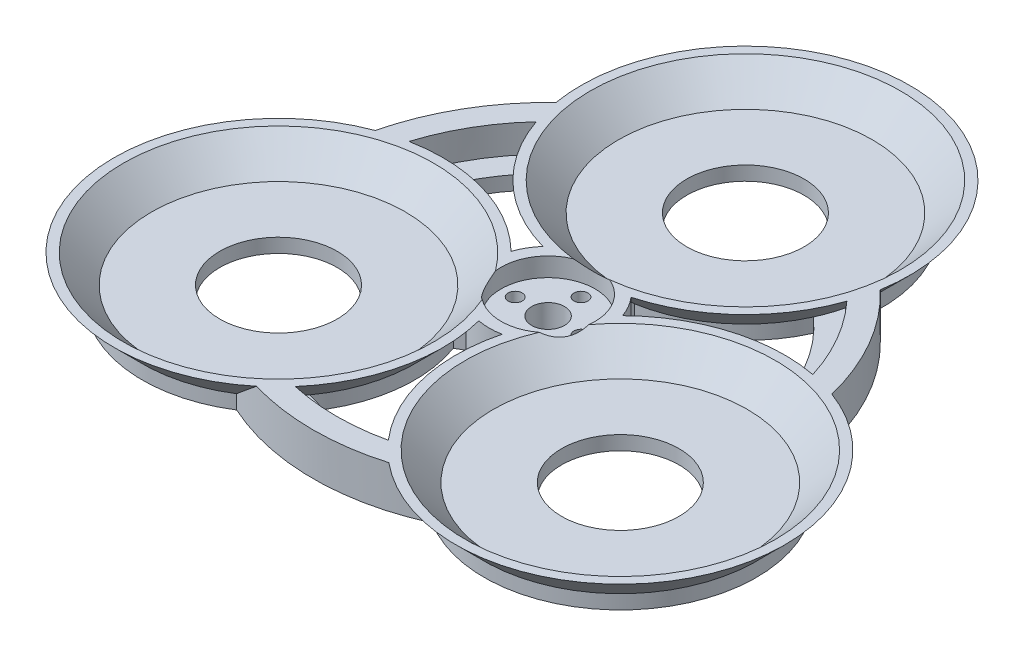
from build123d import *
from build123d.topology import SkipClean

# Parameters (mm, degrees)
SKETCH_1_R               = 10
SKETCH_1_R_2             = 1.5
SKETCH_1_R_3             = 3.5
EXTRUDE_1_DEPTH          = 5
SKETCH_3_R               = 12.5
SKETCH_3_R_2             = 10
EXTRUDE_2_DEPTH          = 9
EXTRUDE_3_DEPTH          = 3
EXTRUDE_4_DEPTH          = 6
PATTERN_CIRCULAR_1_COUNT = 3
SKETCH_13_R              = 12.5
CUT_EXTRUDE_2_DEPTH      = 10
PATTERN_CIRCULAR_2_COUNT = 3
CUT_EXTRUDE_START        = -4
SKETCH_18_R              = 10
CUT_EXTRUDE_3_DEPTH      = 4


with BuildPart() as part:
    # 草图1 → 凸台-拉伸1 (new body)
    with BuildSketch(Plane(origin=(0, 0, 0), x_dir=(1, 0, 0), z_dir=(0, 1, 0))):
        with Locations(Location((0, 0, 0), (0, 0, 270))):
            Circle(SKETCH_1_R)
        with Locations(Location((0, 7, 0), (0, 0, 270))):
            Circle(SKETCH_1_R_2, mode=Mode.SUBTRACT)
        with Locations(Location((0, 0, 0), (0, 0, 270))):
            Circle(SKETCH_1_R_3, mode=Mode.SUBTRACT)
        with Locations(Location((7, 0, 0), (0, 0, 270))):
            Circle(SKETCH_1_R_2, mode=Mode.SUBTRACT)
        with Locations(Location((0, -7, 0), (0, 0, 90))):
            Circle(SKETCH_1_R_2, mode=Mode.SUBTRACT)
        with Locations(Location((-7, 0, 0), (0, 0, 90))):
            Circle(SKETCH_1_R_2, mode=Mode.SUBTRACT)
    extrude(amount=EXTRUDE_1_DEPTH)

    # 草图3 → 凸台-拉伸2 (add)
    with BuildSketch(Plane.XZ):
        with Locations(Location((0, 0, 0), (0, 0, 270))):
            Circle(SKETCH_3_R)
        with Locations(Location((0, 0, 0), (0, 0, 270))):
            Circle(SKETCH_3_R_2, mode=Mode.SUBTRACT)
    extrude(amount=-EXTRUDE_2_DEPTH)

    # 草图4 → 凸台-拉伸3 (add)
    with BuildSketch(Plane(origin=(0, 0, 0), x_dir=(1, 0, 0), z_dir=(0, 1, 0))):
        with BuildLine():
            ThreePointArc((20.804011294, -45.466395437), (61.487803669, -35.5), (49.777059114, 4.716395437))
            ThreePointArc((49.777059114, 4.716395437), (43.301270189, 25), (28.97304782, 40.75))
            ThreePointArc((28.97304782, 40.75), (0, 71), (-28.97304782, 40.75))
            ThreePointArc((-28.97304782, 40.75), (-43.301270189, 25), (-49.777059114, 4.716395437))
            ThreePointArc((-49.777059114, 4.716395437), (-61.487803669, -35.5), (-20.804011294, -45.466395437))
            ThreePointArc((-20.804011294, -45.466395437), (0, -50), (20.804011294, -45.466395437))
        make_face()
        with BuildLine():
            Line((14.134433205, -2.387016124), (12.421567416, -1.3980926))
            ThreePointArc((12.421567416, -1.3980926), (10.825317547, -6.25), (7.421567416, -10.058346638))
            Line((7.421567416, -10.058346638), (9.134433205, -11.047270162))
            ThreePointArc((9.134433205, -11.047270162), (7.640087702, -24.92630908), (12.803210724, -37.895617097))
            ThreePointArc((12.803210724, -37.895617097), (0, -40), (-12.803210724, -37.895617097))
            ThreePointArc((-12.803210724, -37.895617097), (-7.640087702, -24.92630908), (-9.134433205, -11.047270162))
            Line((-9.134433205, -11.047270162), (-7.421567416, -10.058346638))
            ThreePointArc((-7.421567416, -10.058346638), (-10.825317547, -6.25), (-12.421567416, -1.3980926))
            Line((-12.421567416, -1.3980926), (-14.134433205, -2.387016124))
            ThreePointArc((-14.134433205, -2.387016124), (-25.406860737, 5.846644503), (-39.22017246, 7.859902811))
            ThreePointArc((-39.22017246, 7.859902811), (-34.641016151, 20), (-26.416961736, 30.035714286))
            ThreePointArc((-26.416961736, 30.035714286), (-17.766773035, 19.079664577), (-5, 13.434286286))
            Line((-5, 13.434286286), (-5, 11.456439237))
            ThreePointArc((-5, 11.456439237), (0, 12.5), (5, 11.456439237))
            Line((5, 11.456439237), (5, 13.434286286))
            ThreePointArc((5, 13.434286286), (17.766773035, 19.079664577), (26.416961736, 30.035714286))
            ThreePointArc((26.416961736, 30.035714286), (34.641016151, 20), (39.22017246, 7.859902811))
            ThreePointArc((39.22017246, 7.859902811), (25.406860737, 5.846644503), (14.134433205, -2.387016124))
        make_face(mode=Mode.SUBTRACT)
    extrude(amount=EXTRUDE_3_DEPTH)

    # 草图15 → 凸台-拉伸4 (add)
    with BuildSketch(Plane(origin=(0, 3, 0), x_dir=(1, 0, 0), z_dir=(0, 1, 0))):
        with BuildLine():
            Line((-5, 13.434286286), (-5, 11.456439237))
            ThreePointArc((-5, 11.456439237), (0, 12.5), (5, 11.456439237))
            Line((5, 11.456439237), (5, 13.434286286))
            ThreePointArc((5, 13.434286286), (0, 13), (-5, 13.434286286))
        make_face()
        with BuildLine():
            ThreePointArc((-7.421567416, -10.058346638), (-10.825317547, -6.25), (-12.421567416, -1.3980926))
            Line((-12.421567416, -1.3980926), (-14.134433205, -2.387016124))
            ThreePointArc((-14.134433205, -2.387016124), (-11.258330249, -6.5), (-9.134433205, -11.047270162))
            Line((-9.134433205, -11.047270162), (-7.421567416, -10.058346638))
        make_face()
        with BuildLine():
            ThreePointArc((-44.476374018, 6.844863345), (-38.97114317, 22.5), (-28.166012551, 35.095238095))
            ThreePointArc((-28.166012551, 35.095238095), (-28.709095041, 37.902700656), (-28.97304782, 40.75))
            ThreePointArc((-28.97304782, 40.75), (-43.301270189, 25), (-49.777059114, 4.716395437))
            ThreePointArc((-49.777059114, 4.716395437), (-47.179249161, 5.911455297), (-44.476374018, 6.844863345))
        make_face()
        with BuildLine():
            ThreePointArc((28.97304782, 40.75), (28.709095041, 37.902700656), (28.166012551, 35.095238095))
            ThreePointArc((28.166012551, 35.095238095), (38.97114317, 22.5), (44.476374018, 6.844863345))
            ThreePointArc((44.476374018, 6.844863345), (47.179249161, 5.911455297), (49.777059114, 4.716395437))
            ThreePointArc((49.777059114, 4.716395437), (43.301270189, 25), (28.97304782, 40.75))
        make_face()
        with BuildLine():
            Line((14.134433205, -2.387016124), (12.421567416, -1.3980926))
            ThreePointArc((12.421567416, -1.3980926), (10.825317547, -6.25), (7.421567416, -10.058346638))
            Line((7.421567416, -10.058346638), (9.134433205, -11.047270162))
            ThreePointArc((9.134433205, -11.047270162), (11.258330249, -6.5), (14.134433205, -2.387016124))
        make_face()
        with BuildLine():
            ThreePointArc((16.310361467, -41.94010144), (0, -45), (-16.310361467, -41.94010144))
            ThreePointArc((-16.310361467, -41.94010144), (-18.47015412, -43.814155954), (-20.804011294, -45.466395437))
            ThreePointArc((-20.804011294, -45.466395437), (0, -50), (20.804011294, -45.466395437))
            ThreePointArc((20.804011294, -45.466395437), (18.47015412, -43.814155954), (16.310361467, -41.94010144))
        make_face()
    extrude(amount=EXTRUDE_4_DEPTH)

    # 草图5 → 旋转1 (revolve)
    with BuildSketch(Plane(origin=(0, 0, 0), x_dir=(0, 0, -1), z_dir=(1, 0, 0)), mode=Mode.PRIVATE) as revolve_1_sk:
        Polygon((69, 3), (71, 3), (77, 9), (75, 9), align=None)
    revolve_1 = revolve(revolve_1_sk.sketch.rotate(Axis((0, 0, -42), (0, 1, 0)), 170.703106227), axis=Axis((0, 0, -42), (0, 1, 0)))

    # 阵列(圆周)1: 旋转1 ×3 about axis
    pattern_circular_1_axis = Axis((0, 0, 0), (0, 1, 0))
    for i in range(1, PATTERN_CIRCULAR_1_COUNT):
        add(revolve_1.rotate(pattern_circular_1_axis, i * 360 / PATTERN_CIRCULAR_1_COUNT))

    # 草图13 → 切除-拉伸2 (cut)
    with BuildSketch(Plane(origin=(0, 3, 0), x_dir=(1, 0, 0), z_dir=(0, 1, 0))):
        with Locations(Location((0, 42, 0), (0, 0, 270))):
            Circle(SKETCH_13_R)
        with Locations(Location((36.373066959, -21, 0), (0, 0, 270))):
            Circle(SKETCH_13_R)
        with Locations(Location((-36.373066959, -21, 0), (0, 0, 270))):
            Circle(SKETCH_13_R)
    extrude(amount=-CUT_EXTRUDE_2_DEPTH, mode=Mode.SUBTRACT)

    # 草图16 → 切除-旋转1 (revolve, cut)
    with SkipClean():  # the faces are left unmerged after this step: merging them gives an invalid solid
        with BuildSketch(Plane(origin=(0, 0, 0), x_dir=(0, 0, -1), z_dir=(1, 0, 0))):
            Polygon((42, 3), (69, 3), (75, 9), (42, 9), align=None)
        cut_revolve_1 = revolve(axis=Axis((0, 0, -42), (0, 1, 0)), mode=Mode.SUBTRACT)

    # 阵列(圆周)2: 切除-旋转1 ×3 about axis
    with SkipClean():  # the faces are left unmerged after this step: merging them gives an invalid solid
        pattern_circular_2_axis = Axis((0, -0.6, 0), (0, 1, 0))
        for i in range(1, PATTERN_CIRCULAR_2_COUNT):
            add(cut_revolve_1.rotate(pattern_circular_2_axis, i * 360 / PATTERN_CIRCULAR_2_COUNT), mode=Mode.SUBTRACT)

    # 草图18 → 切除-拉伸3 (cut)
    with SkipClean():  # the faces are left unmerged after this step: merging them gives an invalid solid
        with BuildSketch(Plane(origin=(0, 9, 0), x_dir=(1, 0, 0), z_dir=(0, 1, 0)).offset(CUT_EXTRUDE_START)):
            with Locations(Location((0, 0, 0), (0, 0, 112.687977061))):
                Circle(SKETCH_18_R)
        extrude(amount=CUT_EXTRUDE_3_DEPTH, mode=Mode.SUBTRACT)


solid = part.part
